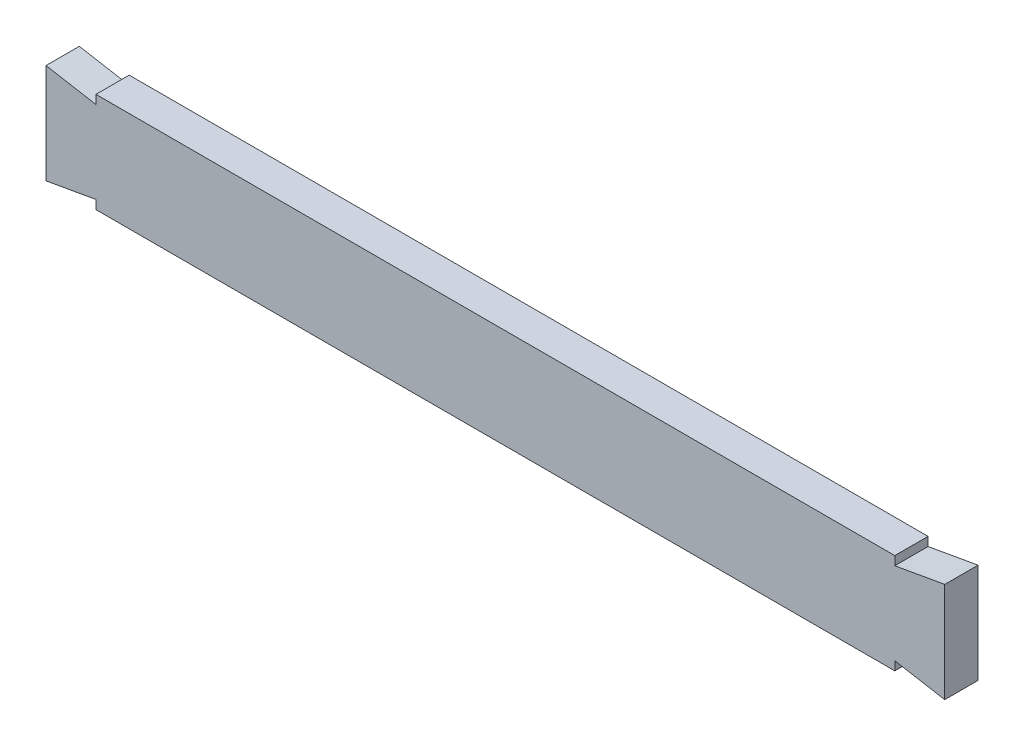
from build123d import *

# Parameters (mm, degrees)
ESQUISSE1_W                  = 270
ESQUISSE1_H                  = 30
BOSS_EXTRU_1_DEPTH           = 10
ENL_V_MAT_EXTRU_1_DEPTH      = 272.845544381
ENL_V_MAT_EXTRU_1_DEPTH_BACK = 272.845544381


with BuildPart() as part:
    # Esquisse1 → Boss.-Extru.1 (new body)
    with BuildSketch(Plane.XY):
        with Locations((135, 15)):
            Rectangle(ESQUISSE1_W, ESQUISSE1_H)
    extrude(amount=BOSS_EXTRU_1_DEPTH)

    # Esquisse2 → Enlèv. mat.-Extru.1 (cut, two sides: drawn at the far end of the back side and taken through both)
    with BuildSketch(Plane.XY.offset(10).offset(-ENL_V_MAT_EXTRU_1_DEPTH_BACK)):
        Polygon((0, 30), (15, 27.355095289), (15, 30), align=None)
        Polygon((15, 2.644904711), (15, 0), (0, 0), align=None)
        Polygon((255, 0), (270, 0), (255, 2.644904711), align=None)
        Polygon((255, 30), (270, 30), (255, 27.355095289), align=None)
    extrude(amount=ENL_V_MAT_EXTRU_1_DEPTH + ENL_V_MAT_EXTRU_1_DEPTH_BACK, mode=Mode.SUBTRACT)


solid = part.part
